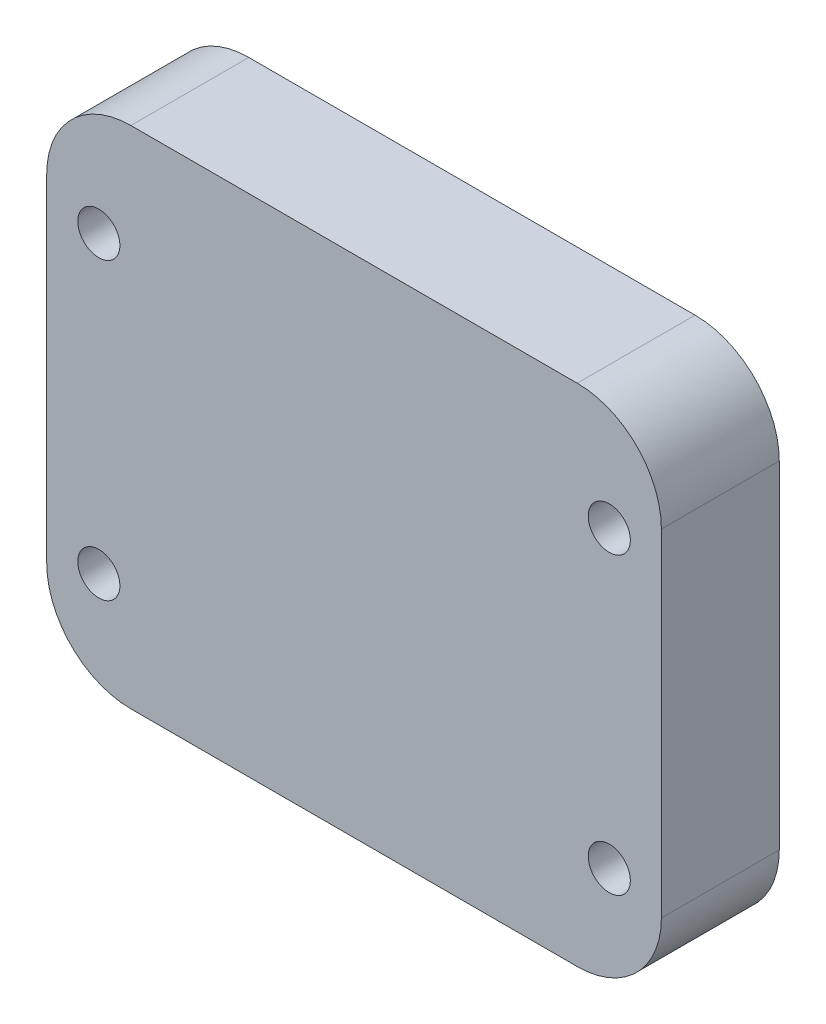
from build123d import *

# Parameters (mm, degrees)
SKETCH1_W          = 73
SKETCH1_H          = 60
PLATE_DEPTH        = 14
SKETCH2_R          = 2.5
CUT_EXTRUDE4_DEPTH = 16
FILLET1_R          = 10
FILLET2_R          = 10
FILLET3_R          = 10
FILLET4_R          = 10


with BuildPart() as part:
    # Sketch1 → Plate (new body)
    with BuildSketch(Plane.XY):
        Rectangle(SKETCH1_W, SKETCH1_H)
    extrude(amount=PLATE_DEPTH)

    # Sketch2 → Cut-Extrude4 (cut)
    with BuildSketch(Plane.XY.offset(14)):
        with Locations((-30.310889135, 17)):
            Circle(SKETCH2_R)
        with Locations((30.310889135, 17)):
            Circle(SKETCH2_R)
        with Locations((30.310889135, -18)):
            Circle(SKETCH2_R)
        with Locations((-30.310889135, -18)):
            Circle(SKETCH2_R)
    extrude(amount=-CUT_EXTRUDE4_DEPTH, mode=Mode.SUBTRACT)

    # Fillet1
    fillet1_edges = [part.edges().sort_by_distance(p)[0] for p in [
        (36.5, -30, 7),
    ]]
    fillet(fillet1_edges, radius=FILLET1_R)

    # Fillet2
    fillet2_edges = [part.edges().sort_by_distance(p)[0] for p in [
        (36.5, 30, 7),
    ]]
    fillet(fillet2_edges, radius=FILLET2_R)

    # Fillet3
    fillet3_edges = [part.edges().sort_by_distance(p)[0] for p in [
        (-36.5, 30, 7),
    ]]
    fillet(fillet3_edges, radius=FILLET3_R)

    # Fillet4
    fillet4_edges = [part.edges().sort_by_distance(p)[0] for p in [
        (-36.5, -30, 7),
    ]]
    fillet(fillet4_edges, radius=FILLET4_R)


solid = part.part
